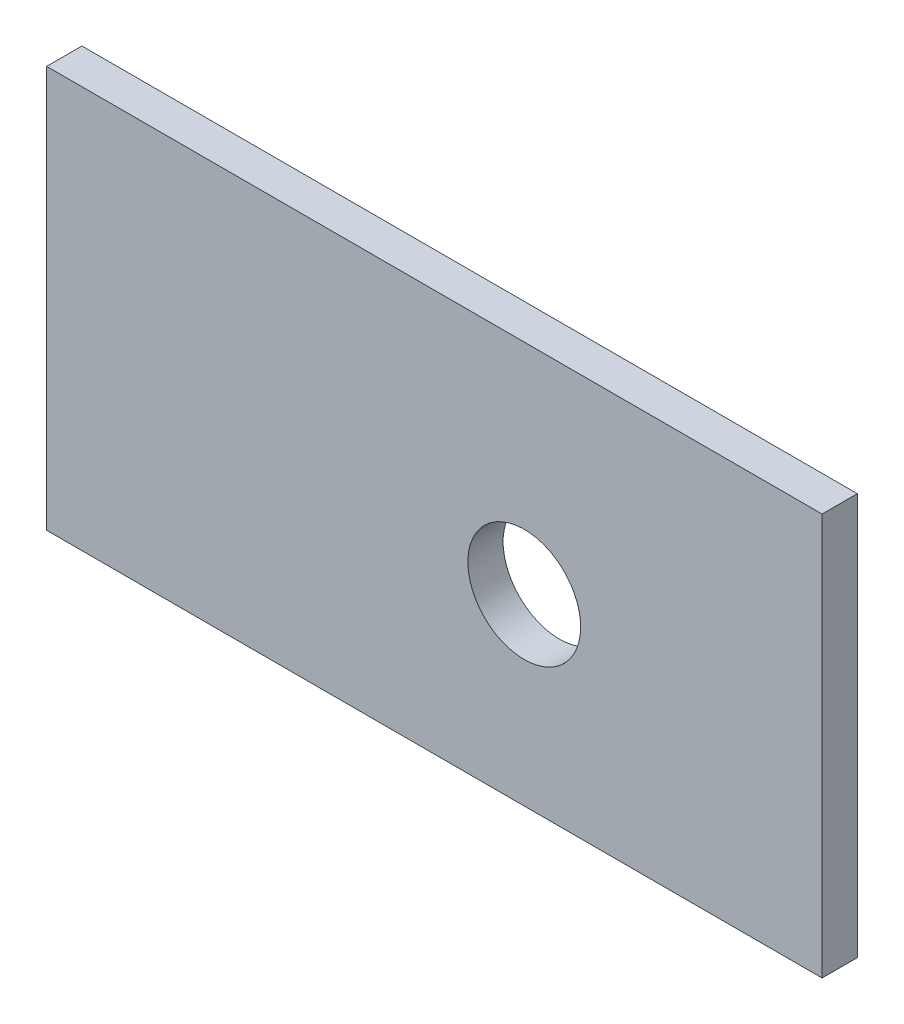
from build123d import *

# Parameters (mm, degrees)
SKETCH_2_W      = 110
SKETCH_2_H      = 57
SKETCH_2_R      = 8
EXTRUDE_1_DEPTH = 5


with BuildPart() as part:
    # 스케치2 → 보스-돌출1 (new body)
    with BuildSketch(Plane.XY):
        Rectangle(SKETCH_2_W, SKETCH_2_H)
        with Locations((12.75, -2.5)):
            Circle(SKETCH_2_R, mode=Mode.SUBTRACT)
    extrude(amount=EXTRUDE_1_DEPTH)


solid = part.part
